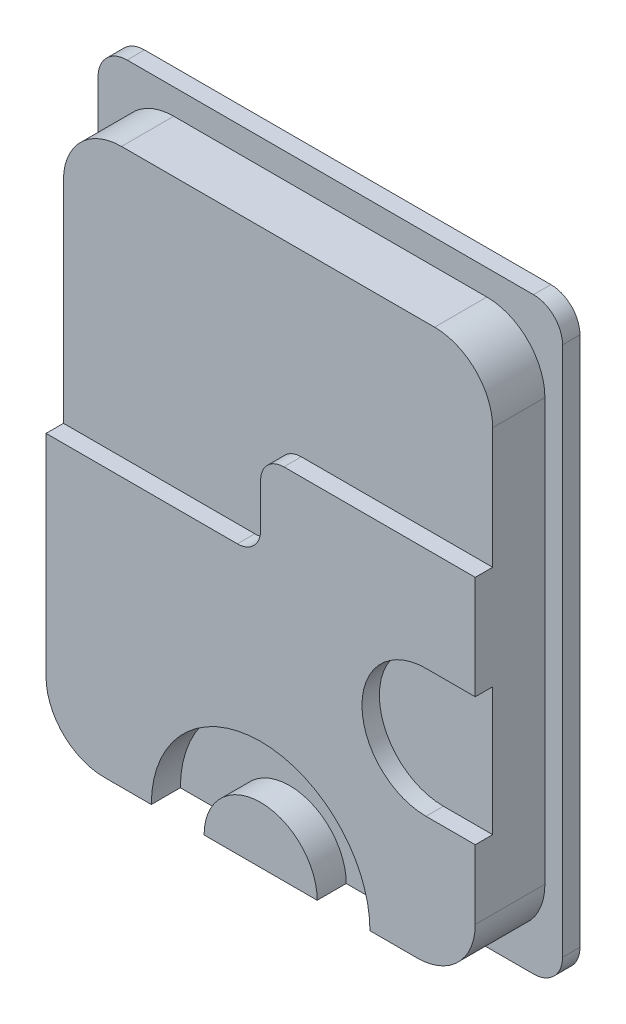
from build123d import *

# Parameters (mm, degrees)
BOSS_EXTRUDE1_DEPTH = 15
SKETCH3_W           = 104.423940592
SKETCH3_H           = 121.358720552
CUT_EXTRUDE1_DEPTH  = 12
CUT_EXTRUDE2_DEPTH  = 3
CUT_EXTRUDE3_DEPTH  = 3
SKETCH6_R           = 18.828058828
SKETCH6_R_2         = 9.739436554
CUT_EXTRUDE4_DEPTH  = 5


with BuildPart() as part:
    # Sketch1 → Boss-Extrude1 (new body)
    with BuildSketch(Plane.XY):
        with BuildLine():
            Line((5, 0), (75, 0))
            ThreePointArc((75, 0), (78.535533906, 1.464466094), (80, 5))
            Line((80, 5), (80, 96.346))
            ThreePointArc((80, 96.346), (78.535533906, 99.881533906), (75, 101.346))
            Line((75, 101.346), (5, 101.346))
            ThreePointArc((5, 101.346), (1.464466094, 99.881533906), (0, 96.346))
            Line((0, 96.346), (0, 5))
            ThreePointArc((0, 5), (1.464466094, 1.464466094), (5, 0))
        make_face()
    extrude(amount=BOSS_EXTRUDE1_DEPTH)

    # Sketch3 → Cut-Extrude1 (cut)
    with BuildSketch(Plane.XY.offset(15)):
        with Locations((40, 50.673)):
            Rectangle(SKETCH3_W, SKETCH3_H)
        with BuildLine():
            Line((13.037037944, 4.371762639), (66.962962056, 4.371762639))
            ThreePointArc((66.962962056, 4.371762639), (74.034029868, 7.300694827), (76.962962056, 14.371762639))
            Line((76.962962056, 14.371762639), (76.962962056, 86.974237361))
            ThreePointArc((76.962962056, 86.974237361), (74.034029868, 94.045305173), (66.962962056, 96.974237361))
            Line((66.962962056, 96.974237361), (13.037037944, 96.974237361))
            ThreePointArc((13.037037944, 96.974237361), (5.965970132, 94.045305173), (3.037037944, 86.974237361))
            Line((3.037037944, 86.974237361), (3.037037944, 14.371762639))
            ThreePointArc((3.037037944, 14.371762639), (5.965970132, 7.300694827), (13.037037944, 4.371762639))
        make_face(mode=Mode.SUBTRACT)
    extrude(amount=-CUT_EXTRUDE1_DEPTH, mode=Mode.SUBTRACT)

    # Sketch4 → Cut-Extrude2 (cut)
    with BuildSketch(Plane.XY.offset(15)):
        with BuildLine():
            Line((36, 50.673), (3.037037944, 50.673))
            Line((3.037037944, 50.673), (3.037037944, 113.13523252))
            Line((3.037037944, 113.13523252), (76.962962056, 113.13523252))
            Line((76.962962056, 113.13523252), (76.962962056, 66.159087484))
            Line((76.962962056, 66.159087484), (44, 66.159087484))
            ThreePointArc((44, 66.159087484), (41.171572875, 64.987514609), (40, 62.159087484))
            Line((40, 62.159087484), (40, 54.673))
            ThreePointArc((40, 54.673), (38.828427125, 51.844572875), (36, 50.673))
        make_face()
    extrude(amount=-CUT_EXTRUDE2_DEPTH, mode=Mode.SUBTRACT)

    # Sketch5 → Cut-Extrude3 (cut)
    with BuildSketch(Plane.XY.offset(15)):
        with BuildLine():
            Line((83.710638267, 26.274744542), (68.481884822, 26.274744542))
            ThreePointArc((68.481884822, 26.274744542), (57.451328272, 37.305301092), (68.481884822, 48.335857641))
            Line((68.481884822, 48.335857641), (83.710638267, 48.335857641))
            ThreePointArc((83.710638267, 48.335857641), (94.741194817, 37.305301092), (83.710638267, 26.274744542))
        make_face()
    extrude(amount=-CUT_EXTRUDE3_DEPTH, mode=Mode.SUBTRACT)

    # Sketch6 → Cut-Extrude4 (cut)
    with BuildSketch(Plane.XY.offset(15)):
        with Locations((40, 4.371762639)):
            Circle(SKETCH6_R)
        with Locations((40, 4.371762639)):
            Circle(SKETCH6_R_2, mode=Mode.SUBTRACT)
    extrude(amount=-CUT_EXTRUDE4_DEPTH, mode=Mode.SUBTRACT)


solid = part.part
